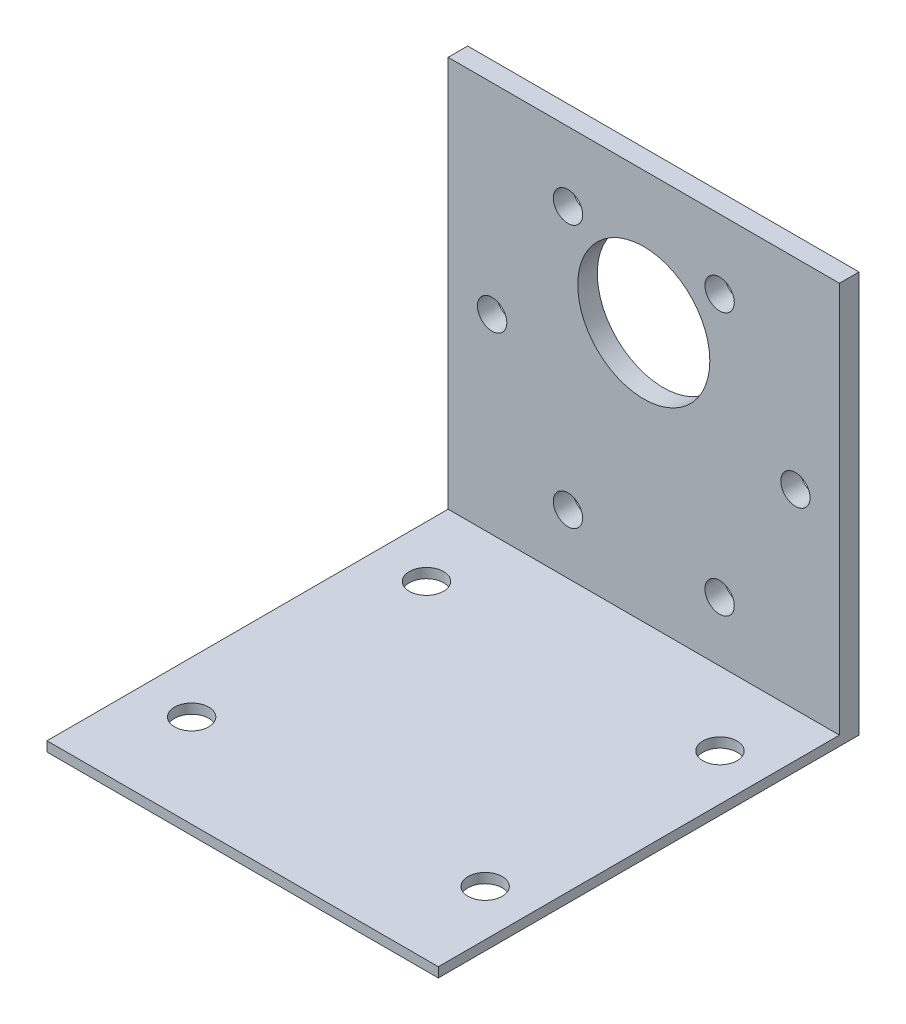
from build123d import *

# Parameters (mm, degrees)
SKETCH1_W           = 40
SKETCH1_H           = 43
SKETCH1_R           = 1.75
BOSS_EXTRUDE1_DEPTH = 1
SKETCH4_W           = 40
SKETCH4_H           = 2
BOSS_EXTRUDE2_DEPTH = 40
SKETCH5_R           = 6.75
CUT_EXTRUDE5_DEPTH  = 34
SKETCH8_R           = 1.5
CUT_EXTRUDE6_DEPTH  = 10


with BuildPart() as part:
    # Sketch1 → Boss-Extrude1 (new body)
    with BuildSketch(Plane(origin=(0, 0, 0), x_dir=(1, 0, 0), z_dir=(0, 1, 0))):
        Rectangle(SKETCH1_W, SKETCH1_H)
        with Locations(Location((-14.715053003, 12, 0), (0, 0, 270))):
            Circle(SKETCH1_R, mode=Mode.SUBTRACT)
        with Locations(Location((15.284946997, 12, 0), (0, 0, 270))):
            Circle(SKETCH1_R, mode=Mode.SUBTRACT)
        with Locations(Location((-14.715053003, -12, 0), (0, 0, 270))):
            Circle(SKETCH1_R, mode=Mode.SUBTRACT)
        with Locations(Location((15.284946997, -12, 0), (0, 0, 270))):
            Circle(SKETCH1_R, mode=Mode.SUBTRACT)
    extrude(amount=-BOSS_EXTRUDE1_DEPTH)

    # Sketch4 → Boss-Extrude2 (add)
    with BuildSketch(Plane(origin=(0, 0, 0), x_dir=(1, 0, 0), z_dir=(0, 1, 0))):
        with Locations((0, 20.5)):
            Rectangle(SKETCH4_W, SKETCH4_H)
    extrude(amount=BOSS_EXTRUDE2_DEPTH)

    # Sketch5 → Cut-Extrude5 (cut)
    with BuildSketch(Plane.XY.offset(-19.5)):
        with Locations((0, 26.5)):
            Circle(SKETCH5_R)
    extrude(amount=-CUT_EXTRUDE5_DEPTH, mode=Mode.SUBTRACT)

    # Sketch8 → Cut-Extrude6 (cut)
    with BuildSketch(Plane.XY.offset(-19.5)):
        with Locations((-15.5, 19.5)):
            Circle(SKETCH8_R)
        with Locations((-7.75, 32.923393759)):
            Circle(SKETCH8_R)
        with Locations((7.75, 32.923393759)):
            Circle(SKETCH8_R)
        with Locations((15.5, 19.5)):
            Circle(SKETCH8_R)
        with Locations((7.75, 6.076606241)):
            Circle(SKETCH8_R)
        with Locations((-7.75, 6.076606241)):
            Circle(SKETCH8_R)
    extrude(amount=-CUT_EXTRUDE6_DEPTH, mode=Mode.SUBTRACT)


solid = part.part
